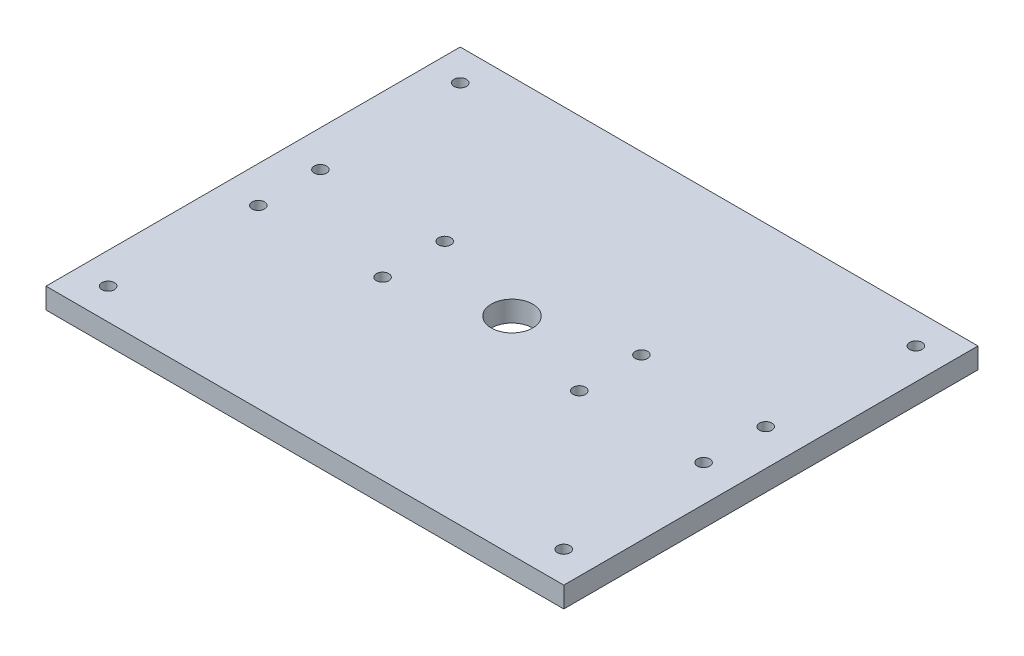
from build123d import *

# Parameters (mm, degrees)
SKETCH1_W                = 100
SKETCH1_H                = 80
BOSS_EXTRUDE1_DEPTH      = 4
M2_CLEARANCE_HOLE1_D     = 2.4
M2_CLEARANCE_HOLE1_DEPTH = 6
M2_CLEARANCE_HOLE2_D     = 2.4
M2_CLEARANCE_HOLE2_DEPTH = 6
F_8_0MM_DOWEL_HOLE1_D    = 8


with BuildPart() as part:
    # Sketch1 → Boss-Extrude1 (new body)
    with BuildSketch(Plane(origin=(0, 0, 0), x_dir=(1, 0, 0), z_dir=(0, 1, 0))):
        with Locations((50, 40)):
            Rectangle(SKETCH1_W, SKETCH1_H)
    extrude(amount=BOSS_EXTRUDE1_DEPTH)

    # M2 Clearance Hole1
    with Locations(Plane(origin=(0, 4, 0), x_dir=(1, 0, 0), z_dir=(0, 1, 0))):
        with Locations((7, 34), (31, 34), (31, 46), (7, 46)):
            m2_clearance_hole1 = Hole(M2_CLEARANCE_HOLE1_D / 2, depth=M2_CLEARANCE_HOLE1_DEPTH)

    # Mirror1: M2 Clearance Hole1 across plane
    add(m2_clearance_hole1.mirror(Plane.ZY.offset(-50)), mode=Mode.SUBTRACT)

    # M2 Clearance Hole2
    with Locations(Plane(origin=(0, 4, 0), x_dir=(1, 0, 0), z_dir=(0, 1, 0))):
        with Locations((6, 74), (94, 74), (94, 6), (6, 6)):
            Hole(M2_CLEARANCE_HOLE2_D / 2, depth=M2_CLEARANCE_HOLE2_DEPTH)

    # Ø8.0mm Dowel Hole1 (through all)
    with Locations(Plane(origin=(0, 4, 0), x_dir=(1, 0, 0), z_dir=(0, 1, 0))):
        with Locations((50, 40)):
            Hole(F_8_0MM_DOWEL_HOLE1_D / 2)


solid = part.part
